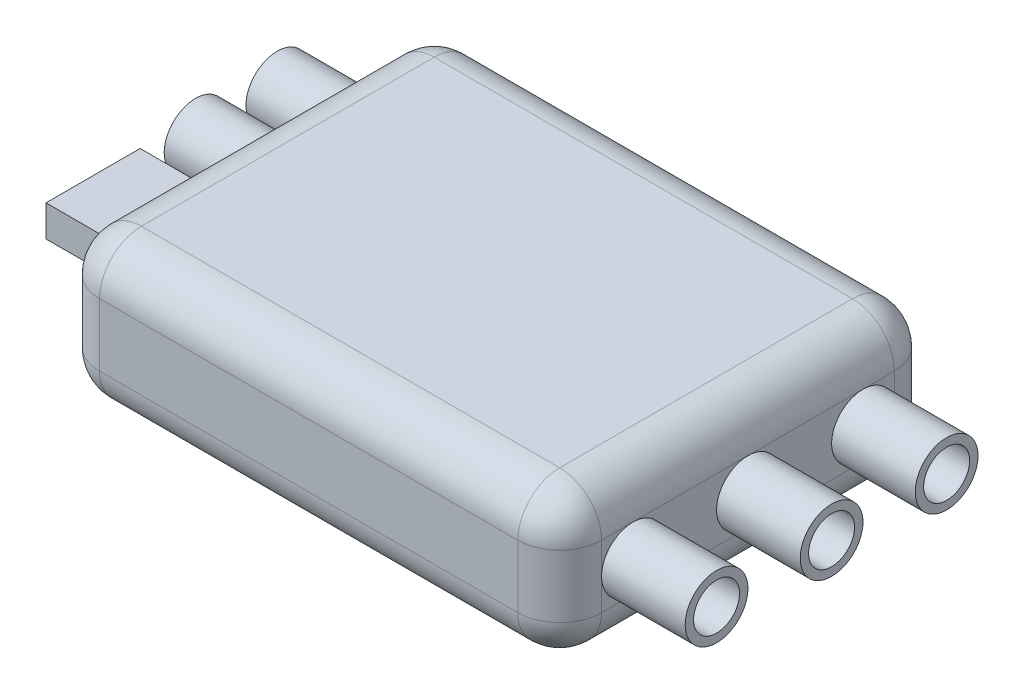
from build123d import *

# Parameters (mm, degrees)
BOSS_EXTRUDE1_DEPTH = 7
FILLET1_R           = 2
SKETCH2_R           = 1.5
SKETCH2_R_2         = 1.1
BOSS_EXTRUDE2_DEPTH = 4
BOSS_EXTRUDE3_START = 4
SKETCH3_R           = 1.5
SKETCH3_R_2         = 1.1
SKETCH3_W           = 4.5
SKETCH3_H           = 1.5
BOSS_EXTRUDE3_DEPTH = 4


with BuildPart() as part:
    # Sketch1 → Boss-Extrude1 (new body)
    with BuildSketch(Plane(origin=(0, 0, 0), x_dir=(1, 0, 0), z_dir=(0, 1, 0))):
        with BuildLine():
            Line((-10, 9), (10, 9))
            ThreePointArc((10, 9), (11.414213562, 8.414213562), (12, 7))
            Line((12, 7), (12, -7))
            ThreePointArc((12, -7), (11.414213562, -8.414213562), (10, -9))
            Line((10, -9), (-10, -9))
            ThreePointArc((-10, -9), (-11.414213562, -8.414213562), (-12, -7))
            Line((-12, -7), (-12, 7))
            ThreePointArc((-12, 7), (-11.414213562, 8.414213562), (-10, 9))
        make_face()
    extrude(amount=BOSS_EXTRUDE1_DEPTH)

    # Fillet1
    fillet1_edges = [part.edges().sort_by_distance(p)[0] for p in [
        (-12, 0, 0),
        (-11.414213562, 0, -8.414213562),
        (0, 0, -9),
        (11.414213562, 0, -8.414213562),
        (-11.414213562, 7, -8.414213562),
        (-12, 7, 0),
        (-11.414213562, 7, 8.414213562),
        (0, 7, 9),
        (11.414213562, 7, 8.414213562),
        (12, 7, 0),
        (11.414213562, 7, -8.414213562),
        (12, 0, 0),
        (0, 7, -9),
        (11.414213562, 0, 8.414213562),
        (0, 0, 9),
        (-11.414213562, 0, 8.414213562),
    ]]
    fillet(fillet1_edges, radius=FILLET1_R)

    # Sketch2 → Boss-Extrude2 (add)
    # profile 1 of 3: a face of its own
    with BuildSketch(Plane(origin=(12, 0, 0), x_dir=(0, 0, -1), z_dir=(1, 0, 0))):
        with Locations(Location((-5.5, 3.5, 0), (0, 0, 180))):
            Circle(SKETCH2_R)
        with Locations((-5.5, 3.5)):
            Circle(SKETCH2_R_2, mode=Mode.SUBTRACT)
    # profile 2 of 3: a face of its own
    with BuildSketch(Plane(origin=(12, 0, 0), x_dir=(0, 0, -1), z_dir=(1, 0, 0))):
        with Locations(Location((0, 3.5, 0), (0, 0, 270))):
            Circle(SKETCH2_R)
        with Locations((0, 3.5)):
            Circle(SKETCH2_R_2, mode=Mode.SUBTRACT)
    # profile 3 of 3: a face of its own
    with BuildSketch(Plane(origin=(12, 0, 0), x_dir=(0, 0, -1), z_dir=(1, 0, 0))):
        with Locations((5.5, 3.5)):
            Circle(SKETCH2_R)
        with Locations((5.5, 3.5)):
            Circle(SKETCH2_R_2, mode=Mode.SUBTRACT)
    extrude(amount=BOSS_EXTRUDE2_DEPTH)

    # Sketch3 → Boss-Extrude3 (add)
    # profile 1 of 3: a face of its own
    with BuildSketch(Plane.ZY.offset(12).offset(BOSS_EXTRUDE3_START)):
        with Locations(Location((-5.5, 3.5, 0), (0, 0, 180))):
            Circle(SKETCH3_R)
        with Locations(Location((-5.5, 3.5, 0), (0, 0, 180))):
            Circle(SKETCH3_R_2, mode=Mode.SUBTRACT)
    # profile 2 of 3: a face of its own
    with BuildSketch(Plane.ZY.offset(12).offset(BOSS_EXTRUDE3_START)):
        with Locations(Location((-1.59, 3.5, 0), (0, 0, 270))):
            Circle(SKETCH3_R)
        with Locations((-1.59, 3.5)):
            Circle(SKETCH3_R_2, mode=Mode.SUBTRACT)
    # profile 3 of 3: a face of its own
    with BuildSketch(Plane.ZY.offset(12).offset(BOSS_EXTRUDE3_START)):
        with Locations((3.31, 3.5)):
            Rectangle(SKETCH3_W, SKETCH3_H)
    extrude(amount=-BOSS_EXTRUDE3_DEPTH)


solid = part.part
